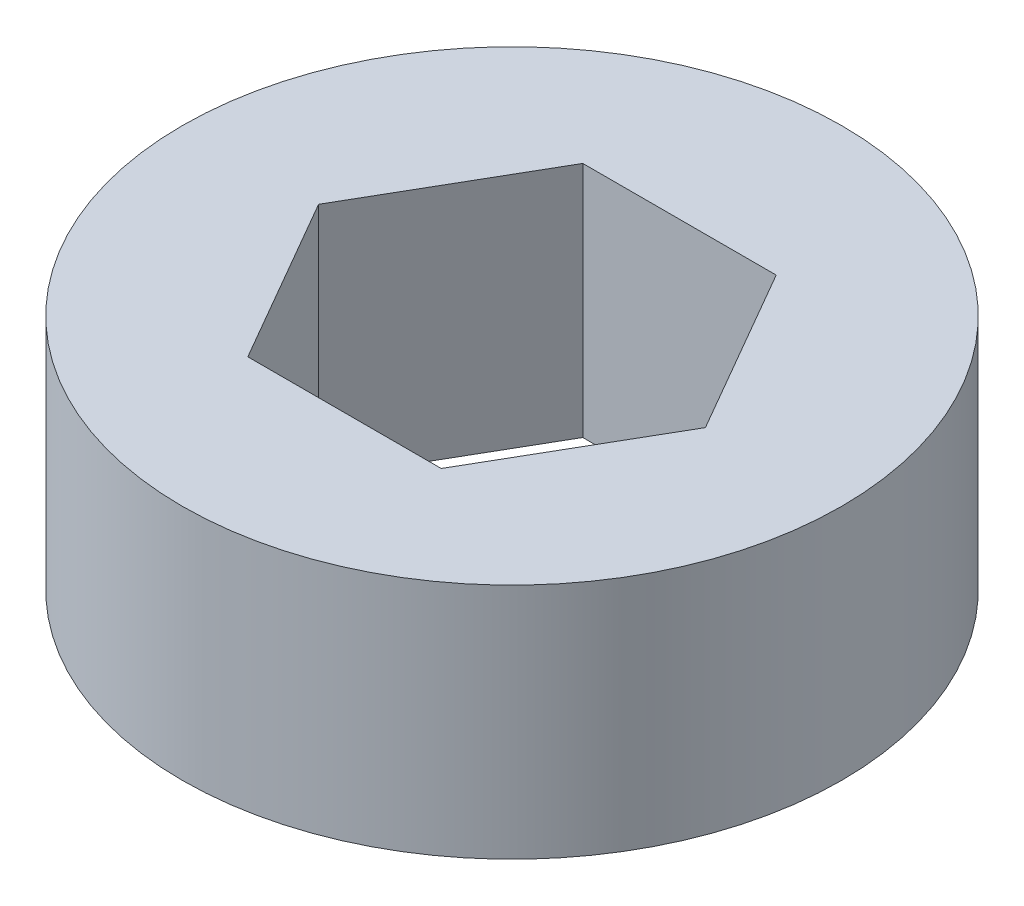
from build123d import *

# Parameters (mm, degrees)
CROQUIS1_R              = 12.5
SALIENTE_EXTRUIR1_DEPTH = 9


with BuildPart() as part:
    # Croquis1 → Saliente-Extruir1 (new body)
    with BuildSketch(Plane(origin=(0, 0, 0), x_dir=(1, 0, 0), z_dir=(0, 1, 0))):
        with Locations(Location((0, 0, 0), (0, 0, 270))):
            Circle(CROQUIS1_R)
        Polygon((7.332348419, 0), (3.666174209, 6.35), (-3.666174209, 6.35), (-7.332348419, 0), (-3.666174209, -6.35), (3.666174209, -6.35), align=None, mode=Mode.SUBTRACT)
    extrude(amount=SALIENTE_EXTRUIR1_DEPTH)


solid = part.part
